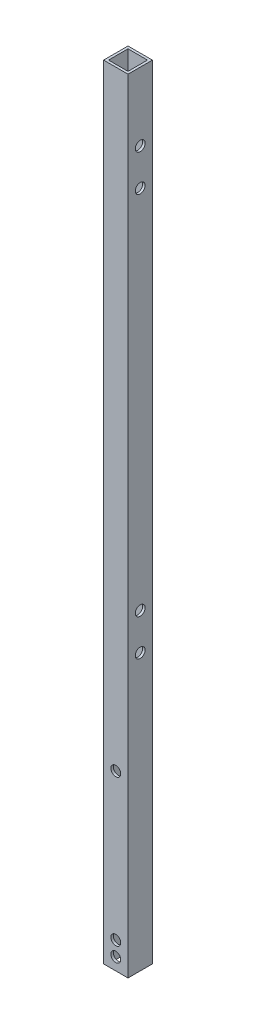
from build123d import *

# Parameters (mm, degrees)
SKETCH1_W           = 10
SKETCH1_H           = 10
SKETCH1_W_2         = 8
SKETCH1_H_2         = 8
BOSS_EXTRUDE1_DEPTH = 340
SKETCH2_R           = 2.025
CUT_EXTRUDE1_DEPTH  = 341.183773863
SKETCH3_R           = 2.028
SKETCH3_R_2         = 2.025
CUT_EXTRUDE2_DEPTH  = 341.183773863
SKETCH4_W           = 10
SKETCH4_H           = 19
CUT_EXTRUDE3_DEPTH  = 341.183773863


with BuildPart() as part:
    # Sketch1 → Boss-Extrude1 (new body)
    with BuildSketch(Plane(origin=(0, 0, 0), x_dir=(1, 0, 0), z_dir=(0, 1, 0))):
        Rectangle(SKETCH1_W, SKETCH1_H)
        Rectangle(SKETCH1_W_2, SKETCH1_H_2, mode=Mode.SUBTRACT)
    extrude(amount=BOSS_EXTRUDE1_DEPTH)

    # Sketch2 → Cut-Extrude1 (cut, through all)
    with BuildSketch(Plane.XY.offset(5)):
        with Locations((0, 90)):
            Circle(SKETCH2_R)
        with Locations((0, 30)):
            Circle(SKETCH2_R)
        with Locations((0, 24)):
            Circle(SKETCH2_R)
    extrude(amount=-CUT_EXTRUDE1_DEPTH, mode=Mode.SUBTRACT)

    # Sketch3 → Cut-Extrude2 (cut, through all)
    with BuildSketch(Plane(origin=(5, 0, 0), x_dir=(0, 0, -1), z_dir=(1, 0, 0))):
        with Locations((0, 312)):
            Circle(SKETCH3_R)
        with Locations((0, 297)):
            Circle(SKETCH3_R_2)
        with Locations((0, 147)):
            Circle(SKETCH3_R_2)
        with Locations((0, 132)):
            Circle(SKETCH3_R_2)
    extrude(amount=-CUT_EXTRUDE2_DEPTH, mode=Mode.SUBTRACT)

    # Sketch4 → Cut-Extrude3 (cut, through all)
    with BuildSketch(Plane.XY.offset(5)):
        with Locations((0, 9.5)):
            Rectangle(SKETCH4_W, SKETCH4_H)
    extrude(amount=-CUT_EXTRUDE3_DEPTH, mode=Mode.SUBTRACT)


solid = part.part
